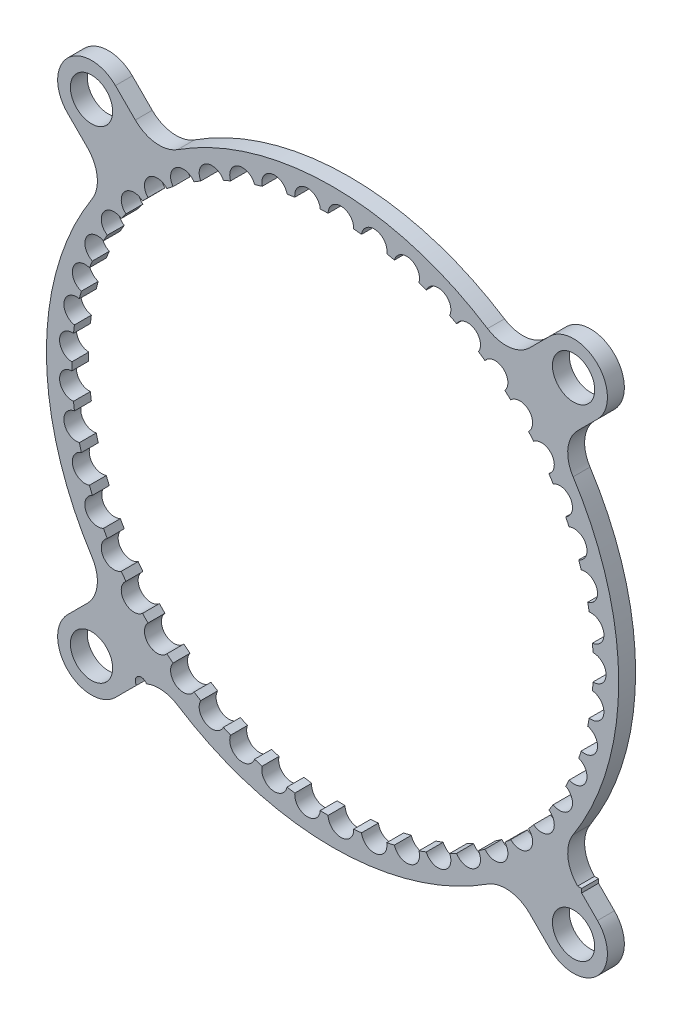
from build123d import *

# Parameters (mm, degrees)
SKETCH_1_R          = 1.51
SKETCH_1_R_2        = 2.5
EXTRUDE_1_DEPTH     = 2
SKETCH_2_R          = 30.83
CUT_EXTRUDE_1_DEPTH = 2
SKETCH_3_R          = 0.7
CUT_EXTRUDE_2_DEPTH = 10


with BuildPart() as part:
    # 草图1 → 凸台-拉伸1 (new body)
    with BuildSketch(Plane.XY):
        with BuildLine():
            Line((25.671320344, -31.328174593), (23.320064467, -28.976918716))
            ThreePointArc((23.320064467, -28.976918716), (20.916937039, -27.828020085), (18.325216056, -28.442814233))
            ThreePointArc((18.325216056, -28.442814233), (0, -33.835), (-18.325216056, -28.442814233))
            ThreePointArc((-18.325216056, -28.442814233), (-20.916937039, -27.828020085), (-23.320064467, -28.976918716))
            Line((-23.320064467, -28.976918716), (-25.671320344, -31.328174593))
            ThreePointArc((-25.671320344, -31.328174593), (-31.328174593, -31.328174593), (-31.328174593, -25.671320344))
            Line((-31.328174593, -25.671320344), (-28.976918716, -23.320064467))
            ThreePointArc((-28.976918716, -23.320064467), (-27.828020085, -20.916937039), (-28.442814233, -18.325216056))
            ThreePointArc((-28.442814233, -18.325216056), (-33.835, 0), (-28.442814233, 18.325216056))
            ThreePointArc((-28.442814233, 18.325216056), (-27.828020085, 20.916937039), (-28.976918716, 23.320064467))
            Line((-28.976918716, 23.320064467), (-31.328174593, 25.671320344))
            ThreePointArc((-31.328174593, 25.671320344), (-31.328174593, 31.328174593), (-25.671320344, 31.328174593))
            Line((-25.671320344, 31.328174593), (-23.320064467, 28.976918716))
            ThreePointArc((-23.320064467, 28.976918716), (-20.916937039, 27.828020085), (-18.325216056, 28.442814233))
            ThreePointArc((-18.325216056, 28.442814233), (0, 33.835), (18.325216056, 28.442814233))
            ThreePointArc((18.325216056, 28.442814233), (20.916937039, 27.828020085), (23.320064467, 28.976918716))
            Line((23.320064467, 28.976918716), (25.671320344, 31.328174593))
            ThreePointArc((25.671320344, 31.328174593), (31.328174593, 31.328174593), (31.328174593, 25.671320344))
            Line((31.328174593, 25.671320344), (28.976918716, 23.320064467))
            ThreePointArc((28.976918716, 23.320064467), (27.828020085, 20.916937039), (28.442814233, 18.325216056))
            ThreePointArc((28.442814233, 18.325216056), (33.835, 0), (28.442814233, -18.325216055))
            ThreePointArc((28.442814233, -18.325216055), (27.828020085, -20.916937039), (28.976918716, -23.320064467))
            Line((28.976918716, -23.320064467), (29.450279484, -23.320064467))
            Line((29.450279484, -23.320064467), (29.450279484, -23.793425235))
            Line((29.450279484, -23.793425235), (31.328174593, -25.671320344))
            ThreePointArc((31.328174593, -25.671320344), (31.328174593, -31.328174593), (25.671320344, -31.328174593))
        make_face()
        with Locations((30.83, 0)):
            Circle(SKETCH_1_R, mode=Mode.SUBTRACT)
        with Locations((30.576886126, -3.942452895)):
            Circle(SKETCH_1_R, mode=Mode.SUBTRACT)
        with Locations((29.821700627, -7.820170822)):
            Circle(SKETCH_1_R, mode=Mode.SUBTRACT)
        with Locations((28.576843629, -11.56948176)):
            Circle(SKETCH_1_R, mode=Mode.SUBTRACT)
        with Locations((26.862755648, -15.128822128)):
            Circle(SKETCH_1_R, mode=Mode.SUBTRACT)
        with Locations((24.707581962, -18.439747655)):
            Circle(SKETCH_1_R, mode=Mode.SUBTRACT)
        with Locations((22.146710464, -21.447893035)):
            Circle(SKETCH_1_R, mode=Mode.SUBTRACT)
        with Locations((19.222190591, -24.103864604)):
            Circle(SKETCH_1_R, mode=Mode.SUBTRACT)
        with Locations((15.982042881, -26.364051383)):
            Circle(SKETCH_1_R, mode=Mode.SUBTRACT)
        with Locations((12.479470468, -28.191341168)):
            Circle(SKETCH_1_R, mode=Mode.SUBTRACT)
        with Locations((8.771985496, -29.555729909)):
            Circle(SKETCH_1_R, mode=Mode.SUBTRACT)
        with Locations((4.920464764, -30.434814383)):
            Circle(SKETCH_1_R, mode=Mode.SUBTRACT)
        with Locations((0.988150137, -30.814160045)):
            Circle(SKETCH_1_R, mode=Mode.SUBTRACT)
        with Locations((-2.960389889, -30.687538052)):
            Circle(SKETCH_1_R, mode=Mode.SUBTRACT)
        with Locations((-6.860320394, -30.057027533)):
            Circle(SKETCH_1_R, mode=Mode.SUBTRACT)
        with Locations((-10.647604628, -28.932981452)):
            Circle(SKETCH_1_R, mode=Mode.SUBTRACT)
        with Locations((-14.260055488, -27.333856615)):
            Circle(SKETCH_1_R, mode=Mode.SUBTRACT)
        with Locations((-17.638356632, -25.285910609)):
            Circle(SKETCH_1_R, mode=Mode.SUBTRACT)
        with Locations((-20.727036447, -22.82277065)):
            Circle(SKETCH_1_R, mode=Mode.SUBTRACT)
        with Locations((-23.475378897, -19.984881427)):
            Circle(SKETCH_1_R, mode=Mode.SUBTRACT)
        with Locations((-25.838256274, -16.818841004)):
            Circle(SKETCH_1_R, mode=Mode.SUBTRACT)
        with Locations((-27.776870197, -13.376635677)):
            Circle(SKETCH_1_R, mode=Mode.SUBTRACT)
        with Locations((-29.25938868, -9.714786362)):
            Circle(SKETCH_1_R, mode=Mode.SUBTRACT)
        with Locations((-30.26146881, -5.893420523)):
            Circle(SKETCH_1_R, mode=Mode.SUBTRACT)
        with Locations((-30.766656458, -1.975284882)):
            Circle(SKETCH_1_R, mode=Mode.SUBTRACT)
        with Locations((-30.766656458, 1.975284882)):
            Circle(SKETCH_1_R, mode=Mode.SUBTRACT)
        with Locations((-30.26146881, 5.893420523)):
            Circle(SKETCH_1_R, mode=Mode.SUBTRACT)
        with Locations((-29.25938868, 9.714786362)):
            Circle(SKETCH_1_R, mode=Mode.SUBTRACT)
        with Locations((-27.776870197, 13.376635677)):
            Circle(SKETCH_1_R, mode=Mode.SUBTRACT)
        with Locations((-25.838256274, 16.818841004)):
            Circle(SKETCH_1_R, mode=Mode.SUBTRACT)
        with Locations((-23.475378897, 19.984881427)):
            Circle(SKETCH_1_R, mode=Mode.SUBTRACT)
        with Locations((-20.727036447, 22.82277065)):
            Circle(SKETCH_1_R, mode=Mode.SUBTRACT)
        with Locations((-17.638356632, 25.285910609)):
            Circle(SKETCH_1_R, mode=Mode.SUBTRACT)
        with Locations((-14.260055488, 27.333856615)):
            Circle(SKETCH_1_R, mode=Mode.SUBTRACT)
        with Locations((-10.647604628, 28.932981452)):
            Circle(SKETCH_1_R, mode=Mode.SUBTRACT)
        with Locations((-6.860320394, 30.057027533)):
            Circle(SKETCH_1_R, mode=Mode.SUBTRACT)
        with Locations((-2.960389889, 30.687538052)):
            Circle(SKETCH_1_R, mode=Mode.SUBTRACT)
        with Locations((0.988150137, 30.814160045)):
            Circle(SKETCH_1_R, mode=Mode.SUBTRACT)
        with Locations((4.920464764, 30.434814383)):
            Circle(SKETCH_1_R, mode=Mode.SUBTRACT)
        with Locations((8.771985496, 29.555729909)):
            Circle(SKETCH_1_R, mode=Mode.SUBTRACT)
        with Locations((12.479470468, 28.191341168)):
            Circle(SKETCH_1_R, mode=Mode.SUBTRACT)
        with Locations((15.982042881, 26.364051383)):
            Circle(SKETCH_1_R, mode=Mode.SUBTRACT)
        with Locations((19.222190591, 24.103864604)):
            Circle(SKETCH_1_R, mode=Mode.SUBTRACT)
        with Locations((22.146710464, 21.447893035)):
            Circle(SKETCH_1_R, mode=Mode.SUBTRACT)
        with Locations((24.707581962, 18.439747655)):
            Circle(SKETCH_1_R, mode=Mode.SUBTRACT)
        with Locations((26.862755648, 15.128822128)):
            Circle(SKETCH_1_R, mode=Mode.SUBTRACT)
        with Locations((28.576843629, 11.56948176)):
            Circle(SKETCH_1_R, mode=Mode.SUBTRACT)
        with Locations((28.499747468, -28.499747468)):
            Circle(SKETCH_1_R_2, mode=Mode.SUBTRACT)
        with Locations((-28.499747468, -28.499747468)):
            Circle(SKETCH_1_R_2, mode=Mode.SUBTRACT)
        with Locations((-28.499747468, 28.499747468)):
            Circle(SKETCH_1_R_2, mode=Mode.SUBTRACT)
        with Locations((28.499747468, 28.499747468)):
            Circle(SKETCH_1_R_2, mode=Mode.SUBTRACT)
        with Locations((29.821700627, 7.820170822)):
            Circle(SKETCH_1_R, mode=Mode.SUBTRACT)
        with Locations((30.576886126, 3.942452895)):
            Circle(SKETCH_1_R, mode=Mode.SUBTRACT)
    extrude(amount=EXTRUDE_1_DEPTH)

    # 草图2 → 切除-拉伸1 (cut)
    with BuildSketch(Plane.XY.offset(2)):
        Circle(SKETCH_2_R)
    extrude(amount=-CUT_EXTRUDE_1_DEPTH, mode=Mode.SUBTRACT)

    # 草图3 → 切除-拉伸2 (cut)
    with BuildSketch(Plane.XY.offset(2)):
        with Locations((-22.625002639, -28.421745316)):
            Circle(SKETCH_3_R)
    extrude(amount=-CUT_EXTRUDE_2_DEPTH, mode=Mode.SUBTRACT)


solid = part.part
